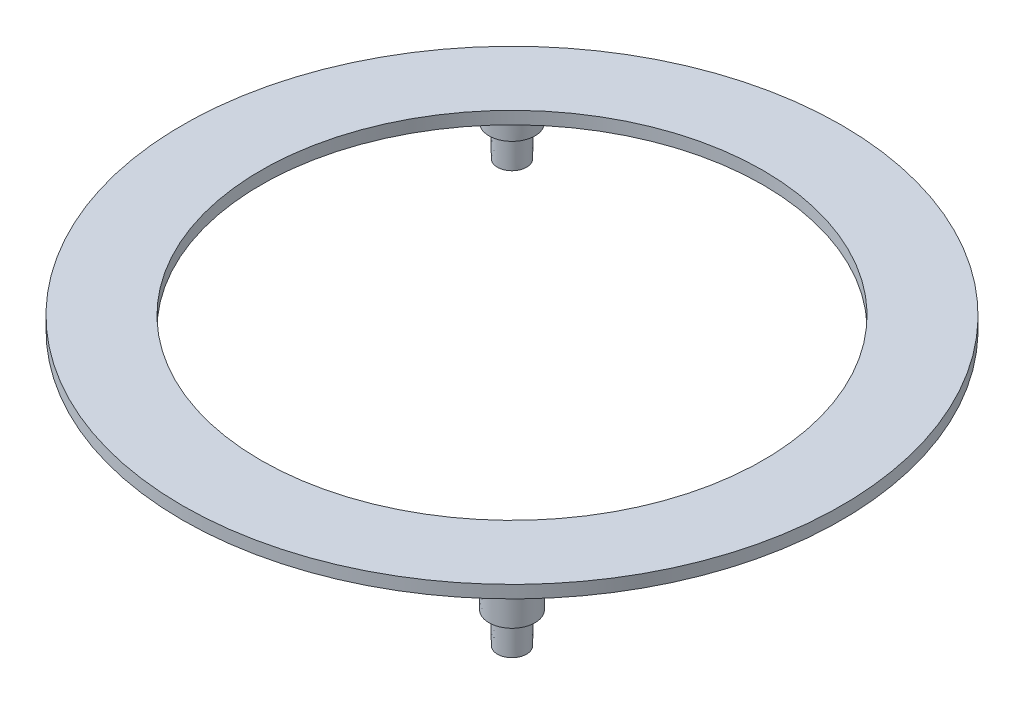
from build123d import *

# Parameters (mm, degrees)
SKETCH1_R           = 10.5
SKETCH1_R_2         = 8
BOSS_EXTRUDE1_DEPTH = 0.4
SKETCH2_R           = 0.75
BOSS_EXTRUDE2_DEPTH = 1
SKETCH3_R           = 0.5
BOSS_EXTRUDE3_DEPTH = 1
CIRPATTERN1_COUNT   = 4
DRAFT1_ANGLE        = 1


with BuildPart() as part:
    # Sketch1 → Boss-Extrude1 (new body)
    with BuildSketch(Plane(origin=(0, 0, 0), x_dir=(1, 0, 0), z_dir=(0, 1, 0))):
        with Locations(Location((0, 1.53064501, 0), (0, 0, 270))):
            Circle(SKETCH1_R)
        with Locations(Location((0, 1.53064501, 0), (0, 0, 270))):
            Circle(SKETCH1_R_2, mode=Mode.SUBTRACT)
    extrude(amount=BOSS_EXTRUDE1_DEPTH)

    # Sketch2 → Boss-Extrude2 (add)
    with BuildSketch(Plane(origin=(0, 0, 0), x_dir=(1, 0, 0), z_dir=(0, 1, 0))):
        with Locations(Location((-6.717514421, -5.186869411, 0), (0, 0, 270))):
            Circle(SKETCH2_R)
    boss_extrude2 = extrude(amount=-BOSS_EXTRUDE2_DEPTH)

    # Sketch3 → Boss-Extrude3 (add)
    with BuildSketch(Plane.XZ.offset(1)):
        with Locations(Location((-6.717514421, 5.186869411, 0), (0, 0, 270))):
            Circle(SKETCH3_R)
    boss_extrude3 = extrude(amount=BOSS_EXTRUDE3_DEPTH)

    # CirPattern1: Boss-Extrude2, Boss-Extrude3 ×4 about axis
    cirpattern1_axis = Axis((0, 0, -1.53064501), (0, 1, 0))
    add([boss_extrude2.rotate(cirpattern1_axis, i * 360 / CIRPATTERN1_COUNT) for i in range(1, CIRPATTERN1_COUNT)])
    add([boss_extrude3.rotate(cirpattern1_axis, i * 360 / CIRPATTERN1_COUNT) for i in range(1, CIRPATTERN1_COUNT)])

    # Draft1
    draft1_faces = [part.faces().sort_by_distance(p)[0] for p in [
        (5.967514421, -0.5, 5.186869411),
        (7.217514421, -1.5, 5.186869411),
        (6.717514421, -0.5, -7.498159431),
        (6.717514421, -1.5, -8.748159431),
        (-5.967514421, -0.5, -8.248159431),
        (-7.217514421, -1.5, -8.248159431),
        (-6.717514421, -0.5, 4.436869411),
        (-6.717514421, -1.5, 5.686869411),
    ]]
    draft(draft1_faces, Plane(origin=(0, 0, -1.53064501), x_dir=(0, 0, -1), z_dir=(0, -1, 0)), DRAFT1_ANGLE)


solid = part.part
